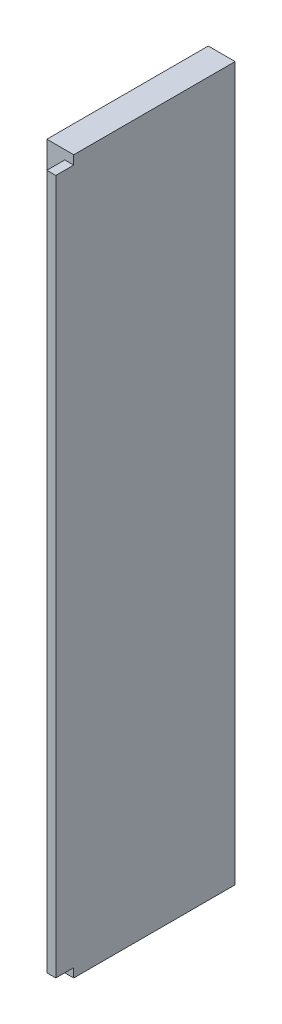
from build123d import *

# Parameters (mm, degrees)
BOSS_EXTRUDE1_DEPTH = 155
SKETCH2_W           = 6
SKETCH2_H           = 36
BOSS_EXTRUDE2_DEPTH = 2
SKETCH3_W           = 6
SKETCH3_H           = 36
BOSS_EXTRUDE3_DEPTH = 2
CUT_EXTRUDE1_REACH  = 160.584
SKETCH4_W           = 3
SKETCH4_H           = 3


with BuildPart() as part:
    # Sketch1 → Boss-Extrude1 (new body)
    with BuildSketch(Plane(origin=(0, 0, 0), x_dir=(1, 0, 0), z_dir=(0, 1, 0))):
        Polygon((0, -16), (0, 16), (-4, 16), (-4, 18), (2, 18), (2, -18), (2, -22), (0, -22), (0, -18), (-4, -18), (-4, -16), align=None)
    extrude(amount=BOSS_EXTRUDE1_DEPTH)

    # Sketch2 → Boss-Extrude2 (add)
    with BuildSketch(Plane(origin=(0, 155, 0), x_dir=(1, 0, 0), z_dir=(0, 1, 0))):
        with Locations((-1, 0)):
            Rectangle(SKETCH2_W, SKETCH2_H)
    extrude(amount=BOSS_EXTRUDE2_DEPTH)

    # Sketch3 → Boss-Extrude3 (add)
    with BuildSketch(Plane.XZ):
        with Locations((-1, 0)):
            Rectangle(SKETCH3_W, SKETCH3_H)
    extrude(amount=BOSS_EXTRUDE3_DEPTH)

    # Sketch4 → Cut-Extrude1 (cut, up to next)
    with BuildSketch(Plane(origin=(0, 0, 0), x_dir=(1, 0, 0), z_dir=(0, 1, 0)), mode=Mode.PRIVATE) as cut_extrude1_sk1:
        with Locations((-1.5, -11)):
            Rectangle(SKETCH4_W, SKETCH4_H)
    cut_extrude1_tool1 = extrude(cut_extrude1_sk1.sketch, amount=-CUT_EXTRUDE1_REACH, mode=Mode.PRIVATE) & part.part
    # Sketch4 → Cut-Extrude1 (cut, up to next)
    with BuildSketch(Plane(origin=(0, 0, 0), x_dir=(1, 0, 0), z_dir=(0, 1, 0)), mode=Mode.PRIVATE) as cut_extrude1_sk2:
        with Locations((-1.5, -3.666666667)):
            Rectangle(SKETCH4_W, SKETCH4_H)
    cut_extrude1_tool2 = extrude(cut_extrude1_sk2.sketch, amount=-CUT_EXTRUDE1_REACH, mode=Mode.PRIVATE) & part.part
    # Sketch4 → Cut-Extrude1 (cut, up to next)
    with BuildSketch(Plane(origin=(0, 0, 0), x_dir=(1, 0, 0), z_dir=(0, 1, 0)), mode=Mode.PRIVATE) as cut_extrude1_sk3:
        with Locations((-1.5, 3.666666667)):
            Rectangle(SKETCH4_W, SKETCH4_H)
    cut_extrude1_tool3 = extrude(cut_extrude1_sk3.sketch, amount=-CUT_EXTRUDE1_REACH, mode=Mode.PRIVATE) & part.part
    # Sketch4 → Cut-Extrude1 (cut, up to next)
    with BuildSketch(Plane(origin=(0, 0, 0), x_dir=(1, 0, 0), z_dir=(0, 1, 0)), mode=Mode.PRIVATE) as cut_extrude1_sk4:
        with Locations((-1.5, 11)):
            Rectangle(SKETCH4_W, SKETCH4_H)
    cut_extrude1_tool4 = extrude(cut_extrude1_sk4.sketch, amount=-CUT_EXTRUDE1_REACH, mode=Mode.PRIVATE) & part.part
    add(cut_extrude1_tool1.solids().sort_by_distance((-1.5, 0, 11))[0], mode=Mode.SUBTRACT)
    add(cut_extrude1_tool2.solids().sort_by_distance((-1.5, 0, 3.666667))[0], mode=Mode.SUBTRACT)
    add(cut_extrude1_tool3.solids().sort_by_distance((-1.5, 0, -3.666667))[0], mode=Mode.SUBTRACT)
    add(cut_extrude1_tool4.solids().sort_by_distance((-1.5, 0, -11))[0], mode=Mode.SUBTRACT)


solid = part.part
